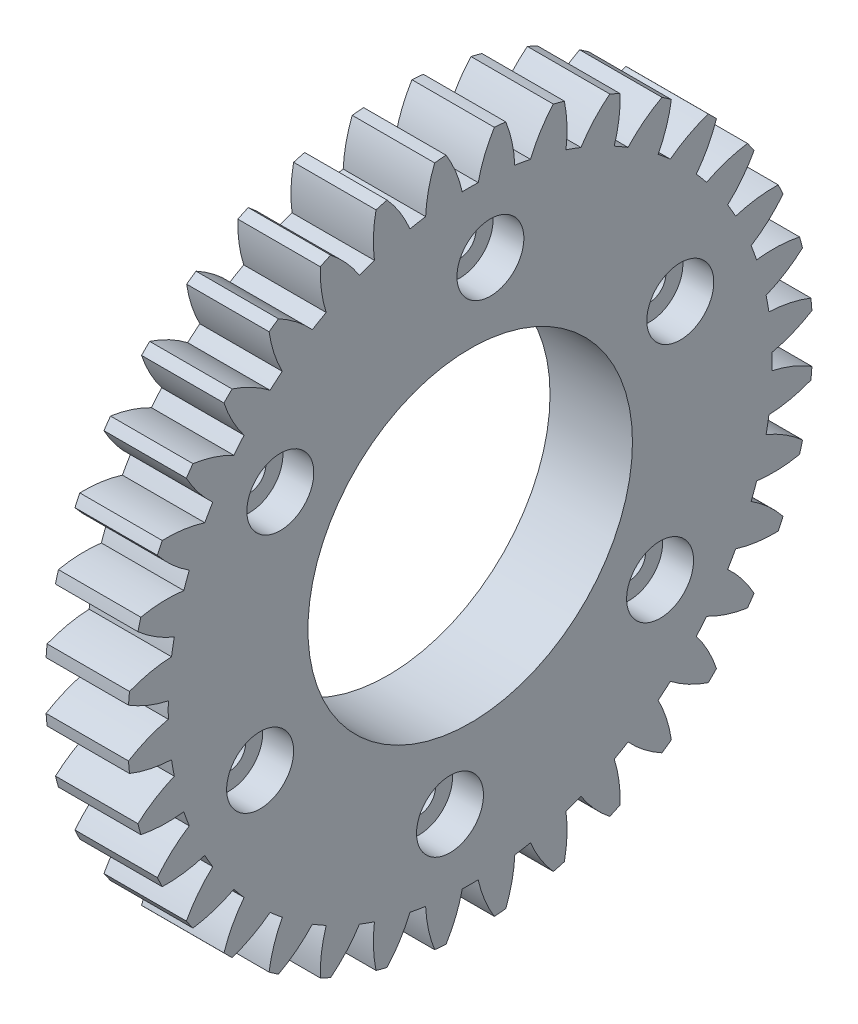
from build123d import *

# Parameters (mm, degrees)
BASPROSKE_W                  = 8
BASPROSKE_H                  = 33.25
TOOTHCUT_DEPTH               = 48.698270409
TEETHCUTS_COUNT              = 36
TEETHCUTS_ANGLE              = 350
BORSKE_R                     = 4
BORE_DEPTH                   = 50.0000508
ESQUISSE1_R                  = 15.75
ENL_V_MAT_EXTRU_1_DEPTH      = 10
ESQUISSE2_R                  = 1.6
ENL_V_MAT_EXTRU_2_DEPTH      = 10
ESQUISSE3_R                  = 3.25
ENL_V_MAT_EXTRU_3_DEPTH      = 3
R_P_TITION_CIRCULAIRE2_COUNT = 6


with BuildPart() as part:
    # BasProSke → Base-Revolve (revolve)
    with BuildSketch(Plane(origin=(0, 0, 0), x_dir=(1, 0, 0), z_dir=(0, 1, 0)), mode=Mode.PRIVATE) as base_revolve_sk:
        with Locations((4, 16.625)):
            Rectangle(BASPROSKE_W, BASPROSKE_H)
    revolve(base_revolve_sk.sketch.rotate(Axis((-10, 0, 0), (1, 0, 0)), 180), axis=Axis((-10, 0, 0), (1, 0, 0)))

    # TooCutSke → ToothCut (cut, through all)
    with BuildSketch(Plane(origin=(0, 0, 0), x_dir=(0, 0, -1), z_dir=(1, 0, 0))):
        with BuildLine():
            ThreePointArc((0.773836769, 29.3012834), (0, 29.3115), (-0.773836769, 29.3012834))
            ThreePointArc((-0.773836769, 29.3012834), (-1.403294931, 31.313012095), (-2.359315682, 33.19165369))
            ThreePointArc((-2.359315682, 33.19165369), (0, 33.2754), (2.359315682, 33.19165369))
            ThreePointArc((2.359315682, 33.19165369), (1.403294931, 31.313012095), (0.773836769, 29.3012834))
        make_face()
    toothcut = extrude(amount=TOOTHCUT_DEPTH, mode=Mode.SUBTRACT)

    # TeethCuts: ToothCut ×36 about axis
    teethcuts_axis = Axis((-10, 0, 0), (1, 0, 0))
    for i in range(1, TEETHCUTS_COUNT):
        add(toothcut.rotate(teethcuts_axis, i * TEETHCUTS_ANGLE / (TEETHCUTS_COUNT - 1)), mode=Mode.SUBTRACT)

    # BorSke → Bore (cut, symmetric)
    with BuildSketch(Plane(origin=(0, 0, 0), x_dir=(0, 0, -1), z_dir=(1, 0, 0))):
        with Locations(Location((0, 0, 0), (0, 0, 180))):
            Circle(BORSKE_R)
    extrude(amount=BORE_DEPTH, both=True, mode=Mode.SUBTRACT)

    # Esquisse1 → Enlèv. mat.-Extru.1 (cut)
    with BuildSketch(Plane(origin=(8, 0, 0), x_dir=(0, 0, -1), z_dir=(1, 0, 0))):
        Circle(ESQUISSE1_R)
    extrude(amount=-ENL_V_MAT_EXTRU_1_DEPTH, mode=Mode.SUBTRACT)

    # Esquisse2 → Enlèv. mat.-Extru.2 (cut)
    with BuildSketch(Plane(origin=(8, 0, 0), x_dir=(0, 0, -1), z_dir=(1, 0, 0))):
        with Locations((1.961004212, 22.414380707)):
            Circle(ESQUISSE2_R)
    enl_v_mat_extru_2 = extrude(amount=-ENL_V_MAT_EXTRU_2_DEPTH, mode=Mode.SUBTRACT)

    # Esquisse3 → Enlèv. mat.-Extru.3 (cut)
    with BuildSketch(Plane(origin=(8, 0, 0), x_dir=(0, 0, -1), z_dir=(1, 0, 0))):
        with Locations((1.961004212, 22.414380707)):
            Circle(ESQUISSE3_R)
    enl_v_mat_extru_3 = extrude(amount=-ENL_V_MAT_EXTRU_3_DEPTH, mode=Mode.SUBTRACT)

    # Répétition circulaire2: Enlèv. mat.-Extru.2, Enlèv. mat.-Extru.3 ×6 about axis
    r_p_tition_circulaire2_axis = Axis((0, 0, 0), (1, 0, 0))
    add([enl_v_mat_extru_2.rotate(r_p_tition_circulaire2_axis, i * 360 / R_P_TITION_CIRCULAIRE2_COUNT) for i in range(1, R_P_TITION_CIRCULAIRE2_COUNT)], mode=Mode.SUBTRACT)
    add([enl_v_mat_extru_3.rotate(r_p_tition_circulaire2_axis, i * 360 / R_P_TITION_CIRCULAIRE2_COUNT) for i in range(1, R_P_TITION_CIRCULAIRE2_COUNT)], mode=Mode.SUBTRACT)


solid = part.part
